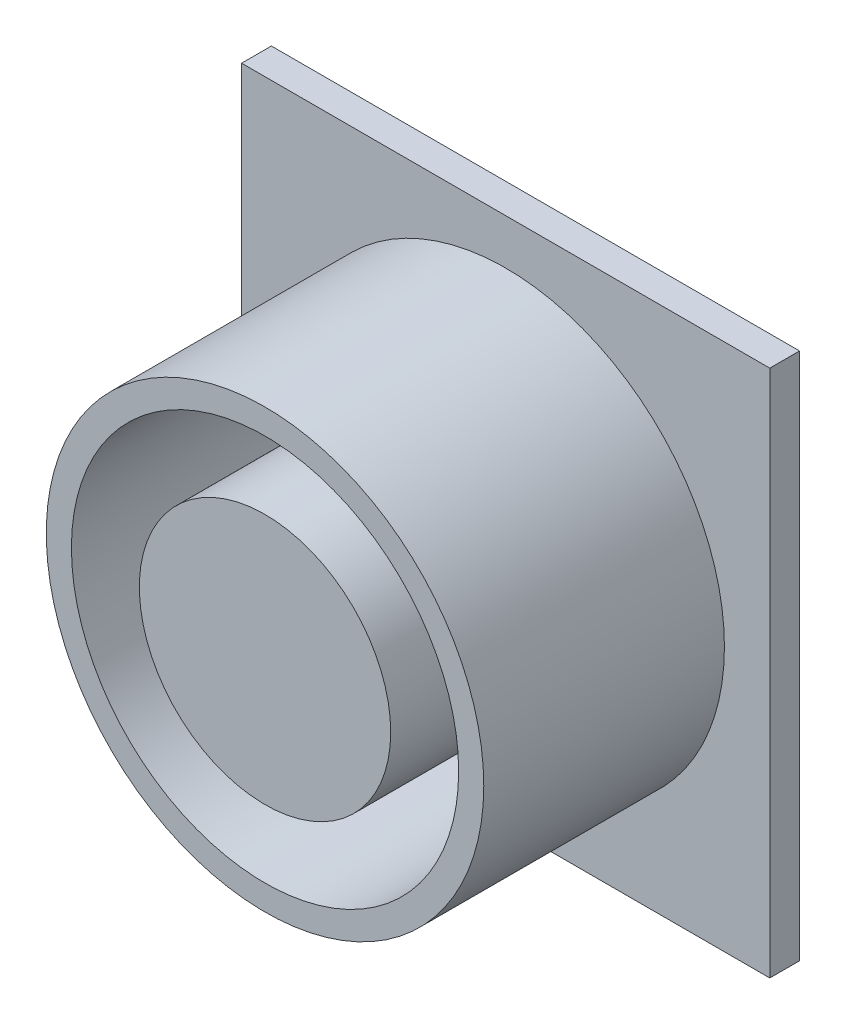
from build123d import *

# Parameters (mm, degrees)
SKETCH1_W           = 70.29196
SKETCH1_H           = 70.29196
BOSS_EXTRUDE1_DEPTH = 3.9624
BOSS_EXTRUDE2_START = 3.9624
SKETCH1_3_R         = 29.111326452
SKETCH1_3_R_2       = 25.7683
BOSS_EXTRUDE2_DEPTH = 32.0294
BOSS_EXTRUDE3_START = 3.9624
SKETCH1_4_R         = 16.7259
BOSS_EXTRUDE3_DEPTH = 32.0294


with BuildPart() as part:
    # Sketch1 → Boss-Extrude1 (new body)
    with BuildSketch(Plane.XY):
        Rectangle(SKETCH1_W, SKETCH1_H)
    extrude(amount=BOSS_EXTRUDE1_DEPTH)

    # Sketch1<3> → Boss-Extrude2 (add)
    with BuildSketch(Plane.XY.offset(BOSS_EXTRUDE2_START)):
        Circle(SKETCH1_3_R)
        Circle(SKETCH1_3_R_2, mode=Mode.SUBTRACT)
    extrude(amount=BOSS_EXTRUDE2_DEPTH)

    # Sketch1<4> → Boss-Extrude3 (add)
    with BuildSketch(Plane.XY.offset(BOSS_EXTRUDE3_START)):
        Circle(SKETCH1_4_R)
    extrude(amount=BOSS_EXTRUDE3_DEPTH)


solid = part.part
